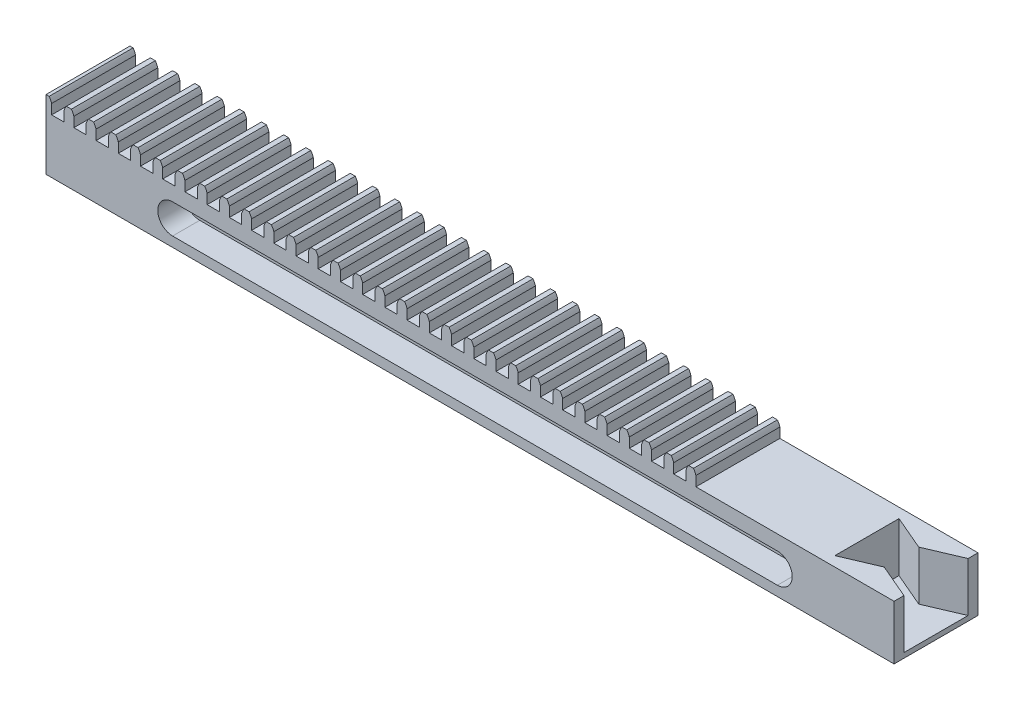
from build123d import *

# Parameters (mm, degrees)
SKETCH1_W           = 250
SKETCH1_H           = 11
BOSS_EXTRUDE1_DEPTH = 17
BOSS_EXTRUDE2_DEPTH = 17
LPATTERN1_COUNT     = 42
LPATTERN1_PITCH     = 4.5
CUT_EXTRUDE1_DEPTH  = 20
SKETCH5_W           = 56.030677885
SKETCH5_H           = 47.082550049
CUT_EXTRUDE3_DEPTH  = 30
SKETCH11_W          = 160
SKETCH11_H          = 6
BOSS_EXTRUDE5_DEPTH = 10
SKETCH12_W          = 23.371483724
SKETCH12_H          = 11
CUT_EXTRUDE4_DEPTH  = 30
CUT_EXTRUDE5_DEPTH  = 10


with BuildPart() as part:
    # Sketch1 → Boss-Extrude1 (new body)
    with BuildSketch(Plane.XY):
        with Locations((16.033868093, 20.123885918)):
            Rectangle(SKETCH1_W, SKETCH1_H)
    extrude(amount=BOSS_EXTRUDE1_DEPTH)

    # Sketch2 → Boss-Extrude2 (add)
    with BuildSketch(Plane.XY):
        with BuildLine():
            Line((-108.966131907, 25.623885918), (-106.966131907, 25.623885918))
            Line((-106.966131907, 25.623885918), (-106.966131907, 27.623885918))
            ThreePointArc((-106.966131907, 27.623885918), (-107.175601842, 28.146403321), (-107.466131907, 28.628580023))
            Line((-107.466131907, 28.628580023), (-108.466131907, 28.628580023))
            ThreePointArc((-108.466131907, 28.628580023), (-108.756661973, 28.146403321), (-108.966131907, 27.623885918))
            Line((-108.966131907, 27.623885918), (-108.966131907, 25.623885918))
        make_face()
    boss_extrude2 = extrude(amount=BOSS_EXTRUDE2_DEPTH)

    # LPattern1: Boss-Extrude2 ×42
    with Locations(*[(i * LPATTERN1_PITCH, 0, 0) for i in range(1, LPATTERN1_COUNT)]):
        add(boss_extrude2)

    # Sketch3 → Cut-Extrude1 (cut)
    with BuildSketch(Plane.XY.offset(17)):
        with BuildLine():
            Line((-28.466131907, 22.623885918), (94.033868093, 22.623885918))
            ThreePointArc((94.033868093, 22.623885918), (97.033868093, 19.623885918), (94.033868093, 16.623885918))
            Line((94.033868093, 16.623885918), (-28.466131907, 16.623885918))
            ThreePointArc((-28.466131907, 16.623885918), (-31.466131907, 19.623885918), (-28.466131907, 22.623885918))
        make_face()
    extrude(amount=-CUT_EXTRUDE1_DEPTH, mode=Mode.SUBTRACT)

    # Sketch5 → Cut-Extrude3 (cut)
    with BuildSketch(Plane.XY.offset(17)):
        with Locations((-82.119600479, 28.295366748)):
            Rectangle(SKETCH5_W, SKETCH5_H)
    extrude(amount=-CUT_EXTRUDE3_DEPTH, mode=Mode.SUBTRACT)

    # Sketch11 → Boss-Extrude5 (add)
    with BuildSketch(Plane.XZ.offset(-14.623885918)):
        with Locations((43.464803279, 8.5)):
            Rectangle(SKETCH11_W, SKETCH11_H)
    extrude(amount=-BOSS_EXTRUDE5_DEPTH)

    # Sketch12 → Cut-Extrude4 (cut)
    with BuildSketch(Plane.XY.offset(17)):
        with Locations((129.348126231, 20.123885918)):
            Rectangle(SKETCH12_W, SKETCH12_H)
    extrude(amount=-CUT_EXTRUDE4_DEPTH, mode=Mode.SUBTRACT)

    # Sketch13 → Cut-Extrude5 (cut)
    with BuildSketch(Plane(origin=(0, 25.623885918, 0), x_dir=(1, 0, 0), z_dir=(0, 1, 0))):
        Polygon((117.662384369, -15), (110.662384369, -12), (103.662384369, -15), (103.662384369, -2), (110.662384369, -5), (117.662384369, -2), align=None)
    extrude(amount=-CUT_EXTRUDE5_DEPTH, mode=Mode.SUBTRACT)


solid = part.part
